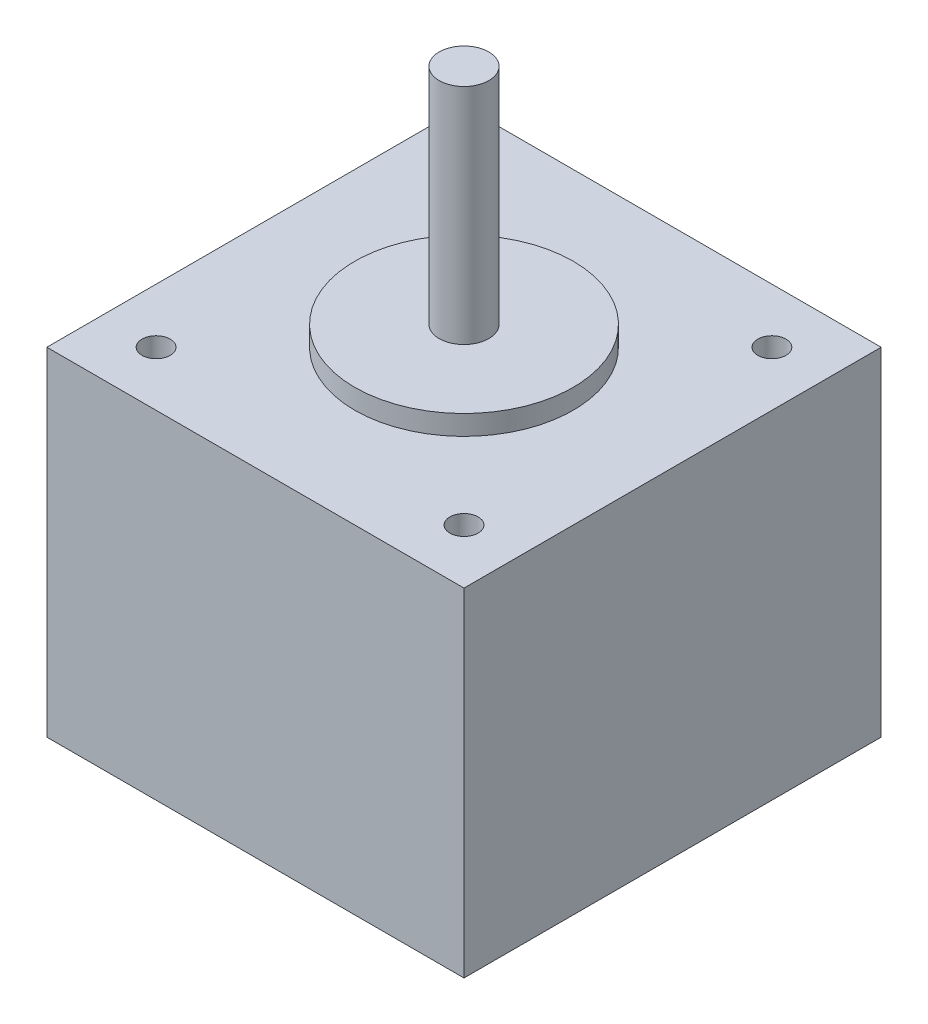
from build123d import *

# Parameters (mm, degrees)
SKETCH1_W           = 42
SKETCH1_H           = 42
BOSS_EXTRUDE1_DEPTH = 34
SKETCH2_R           = 11
BOSS_EXTRUDE2_DEPTH = 2
SKETCH3_R           = 2.5
BOSS_EXTRUDE3_DEPTH = 22.5
SKETCH4_R           = 1.42
CUT_EXTRUDE1_DEPTH  = 5


with BuildPart() as part:
    # Sketch1 → Boss-Extrude1 (new body)
    with BuildSketch(Plane(origin=(0, 0, 0), x_dir=(1, 0, 0), z_dir=(0, 1, 0))):
        Rectangle(SKETCH1_W, SKETCH1_H)
    extrude(amount=BOSS_EXTRUDE1_DEPTH)

    # Sketch2 → Boss-Extrude2 (add)
    with BuildSketch(Plane(origin=(0, 34, 0), x_dir=(1, 0, 0), z_dir=(0, 1, 0))):
        with Locations(Location((0, 0, 0), (0, 0, 90))):
            Circle(SKETCH2_R)
    extrude(amount=BOSS_EXTRUDE2_DEPTH)

    # Sketch3 → Boss-Extrude3 (add)
    with BuildSketch(Plane(origin=(0, 36, 0), x_dir=(1, 0, 0), z_dir=(0, 1, 0))):
        with Locations(Location((0, 0, 0), (0, 0, 90))):
            Circle(SKETCH3_R)
    extrude(amount=BOSS_EXTRUDE3_DEPTH)

    # Sketch4 → Cut-Extrude1 (cut)
    with BuildSketch(Plane(origin=(0, 34, 0), x_dir=(1, 0, 0), z_dir=(0, 1, 0))):
        with Locations(Location((-15.5, 15.5, 0), (0, 0, 270))):
            Circle(SKETCH4_R)
        with Locations(Location((15.5, 15.5, 0), (0, 0, 270))):
            Circle(SKETCH4_R)
        with Locations(Location((15.5, -15.5, 0), (0, 0, 270))):
            Circle(SKETCH4_R)
        with Locations(Location((-15.5, -15.5, 0), (0, 0, 270))):
            Circle(SKETCH4_R)
    extrude(amount=-CUT_EXTRUDE1_DEPTH, mode=Mode.SUBTRACT)


solid = part.part
